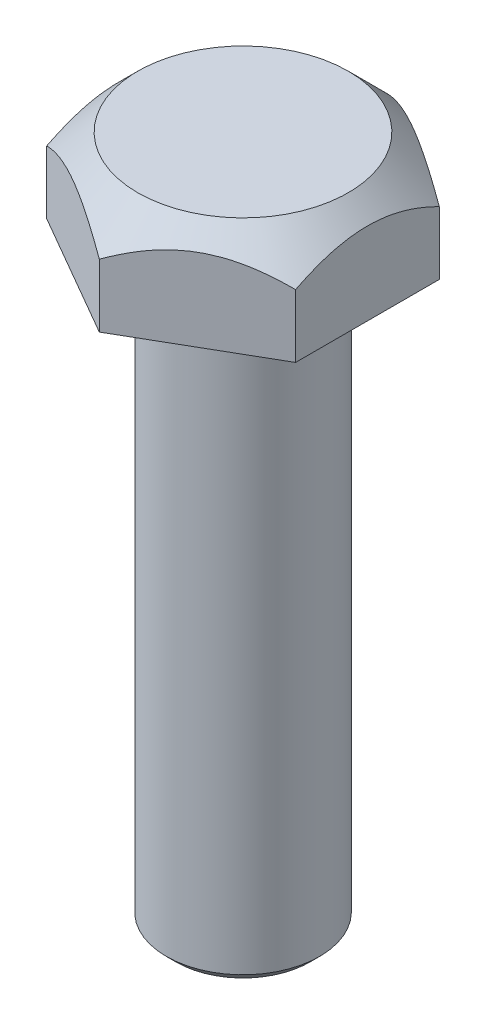
from build123d import *

# Parameters (mm, degrees)
BOSS_EXTRUDE1_DEPTH = 5.3
SKETCH2_R           = 4
BOSS_EXTRUDE3_DEPTH = 30.5
CHAMFER5_SIZE       = 0.5
SKETCH4_OUTSIDE_W   = 27.188
SKETCH4_OUTSIDE_H   = 29.2
SKETCH4_OUTSIDE_R   = 5.5
CUT_EXTRUDE7_DEPTH  = 2
CUT_EXTRUDE7_DRAFT  = -45


with BuildPart() as part:
    # Sketch1 → Boss-Extrude1 (new body)
    with BuildSketch(Plane(origin=(0, 0, 0), x_dir=(1, 0, 0), z_dir=(0, 1, 0))):
        Polygon((0, 7.505553499), (-6.5, 3.75277675), (-6.5, -3.75277675), (0, -7.505553499), (6.5, -3.75277675), (6.5, 3.75277675), align=None)
    extrude(amount=BOSS_EXTRUDE1_DEPTH)

    # Sketch2 → Boss-Extrude3 (add)
    with BuildSketch(Plane(origin=(0, 0, 0), x_dir=(1, 0, 0), z_dir=(0, 1, 0))):
        with Locations(Location((0, 0, 0), (0, 0, 270))):
            Circle(SKETCH2_R)
    extrude(amount=-BOSS_EXTRUDE3_DEPTH)

    # Chamfer5
    chamfer5_edges = [part.edges().sort_by_distance(p)[0] for p in [
        (0, -30.5, -4),
    ]]
    chamfer(chamfer5_edges, length=CHAMFER5_SIZE)


with BuildPart() as cut_extrude7_tool:
    # Sketch4 outside → Cut-Extrude7 (with draft: the straight prism first)
    with BuildSketch(Plane(origin=(0, 5.3, 0), x_dir=(1, 0, 0), z_dir=(0, 1, 0))):
        Rectangle(SKETCH4_OUTSIDE_W, SKETCH4_OUTSIDE_H)
        Circle(SKETCH4_OUTSIDE_R, mode=Mode.SUBTRACT)
    extrude(amount=-CUT_EXTRUDE7_DEPTH)
    # Cut-Extrude7: the draft: its side faces are tilted about the plane it starts from
    cut_extrude7_sides = [cut_extrude7_tool.faces().sort_by_distance(p)[0] for p in [
        (0, 4.3, 14.6),
        (13.594, 4.3, 0),
        (0, 4.3, -14.6),
        (-13.594, 4.3, 0),
        (-5.5, 4.3, 0),
    ]]
    draft(cut_extrude7_sides, Plane(origin=(0, 5.3, 0), x_dir=(1, 0, 0), z_dir=(0, 1, 0)), CUT_EXTRUDE7_DRAFT)


with BuildPart() as part_1:
    add(part.part)

    # Cut-Extrude7: cut by cut_extrude7_tool
    add(cut_extrude7_tool.part, mode=Mode.SUBTRACT)


solid = part_1.part
